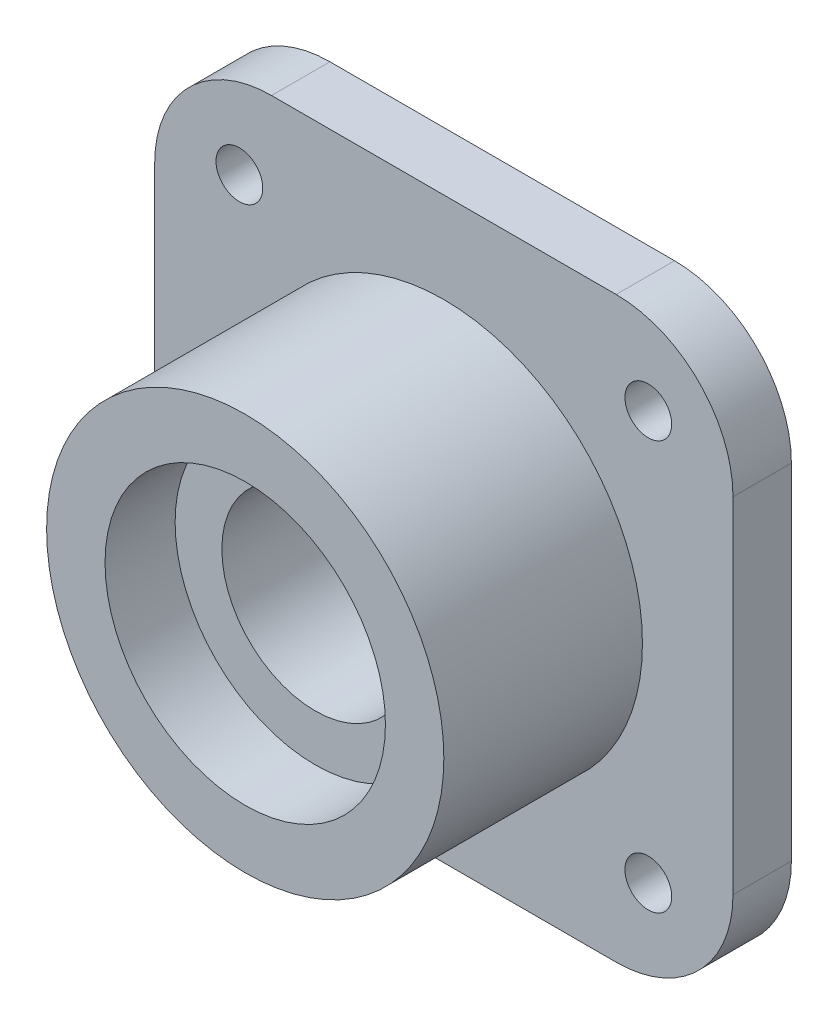
from build123d import *

# Parameters (mm, degrees)
CUT_EXTRUDE1_DEPTH = 10
FILLET1_R          = 10
SKETCH5_R          = 2
CUT_EXTRUDE2_DEPTH = 10


with BuildPart() as part:
    # Sketch3 → Revolve1 (revolve)
    with BuildSketch(Plane(origin=(0, 0, 0), x_dir=(0, 0, -1), z_dir=(1, 0, 0)), mode=Mode.PRIVATE) as revolve1_sk:
        Polygon((0, 12), (6, 12), (6, 8), (16, 8), (16, 12), (22, 12), (22, 35), (17, 35), (17, 17), (0, 17), align=None)
    revolve(revolve1_sk.sketch.rotate(Axis((0, 0, 0), (0, 0, -1)), 90), axis=Axis((0, 0, 0), (0, 0, -1)))

    # Sketch4 → Cut-Extrude1 (cut)
    with BuildSketch(Plane.XY.offset(-17)):
        with BuildLine():
            ThreePointArc((35, 0), (32.335783638, 13.393920133), (24.748737342, 24.748737342))
            Line((24.748737342, 24.748737342), (24.748737342, -24.748737342))
            ThreePointArc((24.748737342, -24.748737342), (32.335783638, -13.393920133), (35, 0))
        make_face()
        with BuildLine():
            ThreePointArc((24.748737342, 24.748737342), (0, 35), (-24.748737342, 24.748737342))
            Line((-24.748737342, 24.748737342), (24.748737342, 24.748737342))
        make_face()
        with BuildLine():
            Line((-24.748737342, -24.748737342), (-24.748737342, 24.748737342))
            ThreePointArc((-24.748737342, 24.748737342), (-35, 0), (-24.748737342, -24.748737342))
        make_face()
        with BuildLine():
            Line((24.748737342, -24.748737342), (-24.748737342, -24.748737342))
            ThreePointArc((-24.748737342, -24.748737342), (0, -35), (24.748737342, -24.748737342))
        make_face()
    extrude(amount=-CUT_EXTRUDE1_DEPTH, mode=Mode.SUBTRACT)

    # Fillet1
    fillet1_edges = [part.edges().sort_by_distance(p)[0] for p in [
        (24.748737342, 24.748737342, -19.5),
        (24.748737342, -24.748737342, -19.5),
        (-24.748737342, 24.748737342, -19.5),
        (-24.748737342, -24.748737342, -19.5),
    ]]
    fillet(fillet1_edges, radius=FILLET1_R)

    # Sketch5 → Cut-Extrude2 (cut)
    with BuildSketch(Plane(origin=(0, 0, -22), x_dir=(-1, 0, 0), z_dir=(0, 0, -1))):
        with Locations((-17.5, 17.5)):
            Circle(SKETCH5_R)
        with Locations((17.5, 17.5)):
            Circle(SKETCH5_R)
        with Locations((17.5, -17.5)):
            Circle(SKETCH5_R)
        with Locations((-17.5, -17.5)):
            Circle(SKETCH5_R)
    extrude(amount=-CUT_EXTRUDE2_DEPTH, mode=Mode.SUBTRACT)


solid = part.part
